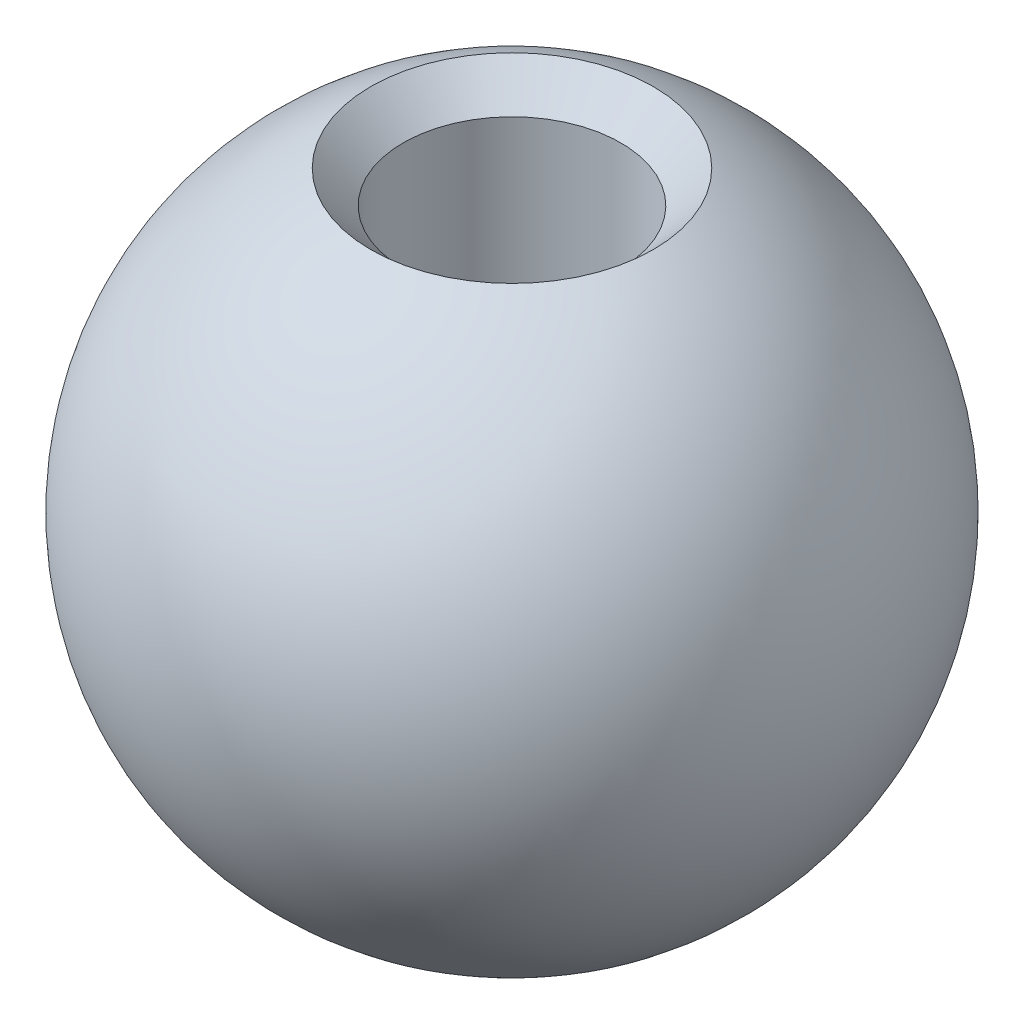
from build123d import *

# Parameters (mm, degrees)
HOLE_WIZARD_M4_1_D           = 3.3
HOLE_WIZARD_M4_1_DEPTH       = 7
HOLE_WIZARD_M4_1_CSINK_D     = 5.25
HOLE_WIZARD_M4_1_CSINK_ANGLE = 90
HOLE_WIZARD_M4_1_TIP         = 0.991420021


with BuildPart() as part:
    # 草图1 → 旋转1 (revolve)
    with BuildSketch(Plane.XY):
        with BuildLine():
            Line((0, 5), (0, -5))
            ThreePointArc((0, -5), (5, 0), (0, 5))
        make_face()
    revolve(axis=Axis((0, 0, 0), (0, 1, 0)))

    # M4 螺纹孔1
    with Locations(Plane(origin=(0, 5, 0), x_dir=(1, 0, 0), z_dir=(0, 1, 0))):
        with Locations((0, 0)):
            CounterSinkHole(HOLE_WIZARD_M4_1_D / 2, HOLE_WIZARD_M4_1_CSINK_D / 2, depth=HOLE_WIZARD_M4_1_DEPTH, counter_sink_angle=HOLE_WIZARD_M4_1_CSINK_ANGLE)
            with Locations((0, 0, -(HOLE_WIZARD_M4_1_DEPTH + HOLE_WIZARD_M4_1_TIP / 2))):  # 118° drill point
                Cone(0, HOLE_WIZARD_M4_1_D / 2, HOLE_WIZARD_M4_1_TIP, mode=Mode.SUBTRACT)


solid = part.part
